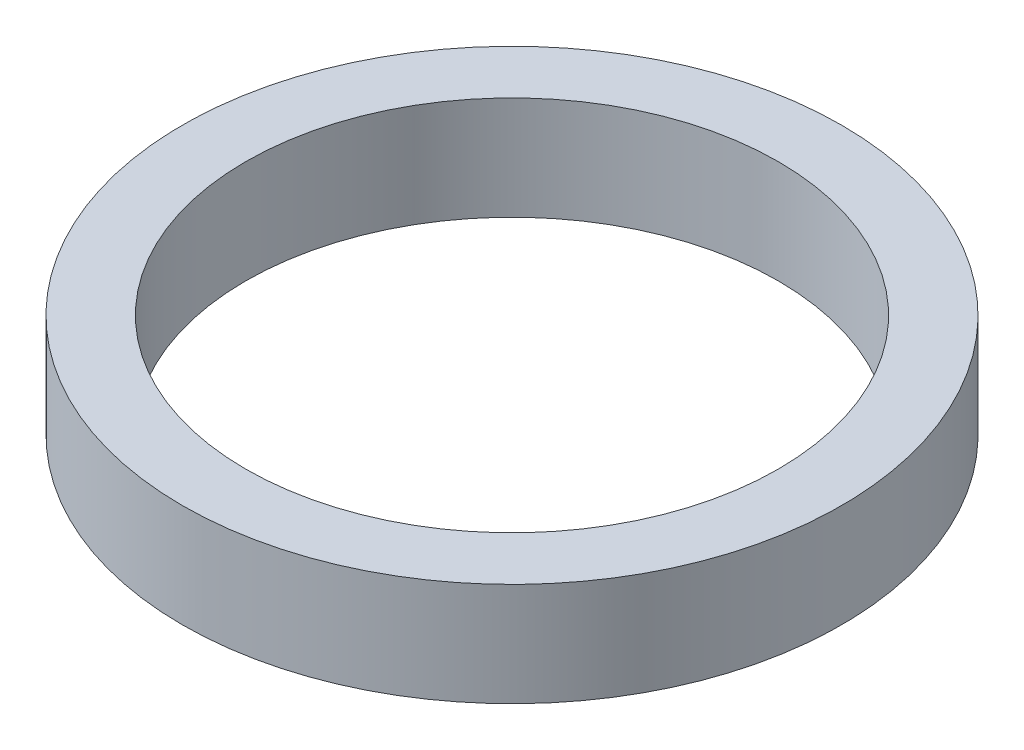
from build123d import *

# Parameters (mm, degrees)
SKETCH1_R           = 15.63
SKETCH1_R_2         = 12.63
BOSS_EXTRUDE1_DEPTH = 4.9


with BuildPart() as part:
    # Sketch1 → Boss-Extrude1 (new body)
    with BuildSketch(Plane(origin=(0, 0, 0), x_dir=(1, 0, 0), z_dir=(0, 1, 0))):
        with Locations(Location((0, 0, 0), (0, 0, 270))):
            Circle(SKETCH1_R)
        with Locations(Location((0, 0, 0), (0, 0, 270))):
            Circle(SKETCH1_R_2, mode=Mode.SUBTRACT)
    extrude(amount=BOSS_EXTRUDE1_DEPTH)


solid = part.part
